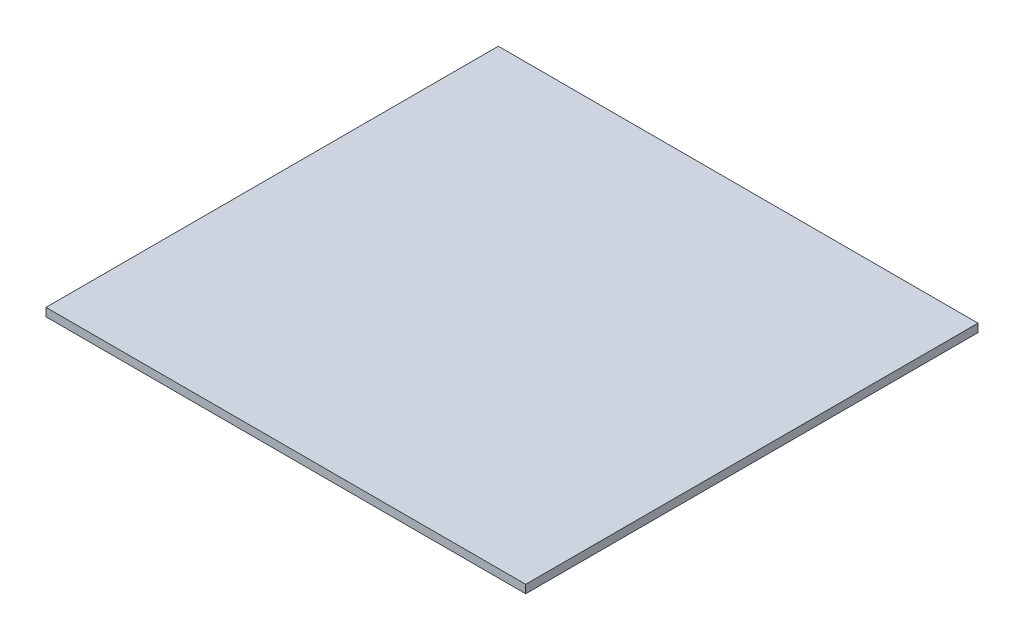
from build123d import *

# Parameters (mm, degrees)
ESQUISSE1_W        = 350
ESQUISSE1_H        = 330
BOSS_EXTRU_1_DEPTH = 6


with BuildPart() as part:
    # Esquisse1 → Boss.-Extru.1 (new body)
    with BuildSketch(Plane(origin=(0, 0, 0), x_dir=(1, 0, 0), z_dir=(0, 1, 0))):
        with Locations((-175, 165)):
            Rectangle(ESQUISSE1_W, ESQUISSE1_H)
    extrude(amount=BOSS_EXTRU_1_DEPTH)


solid = part.part
